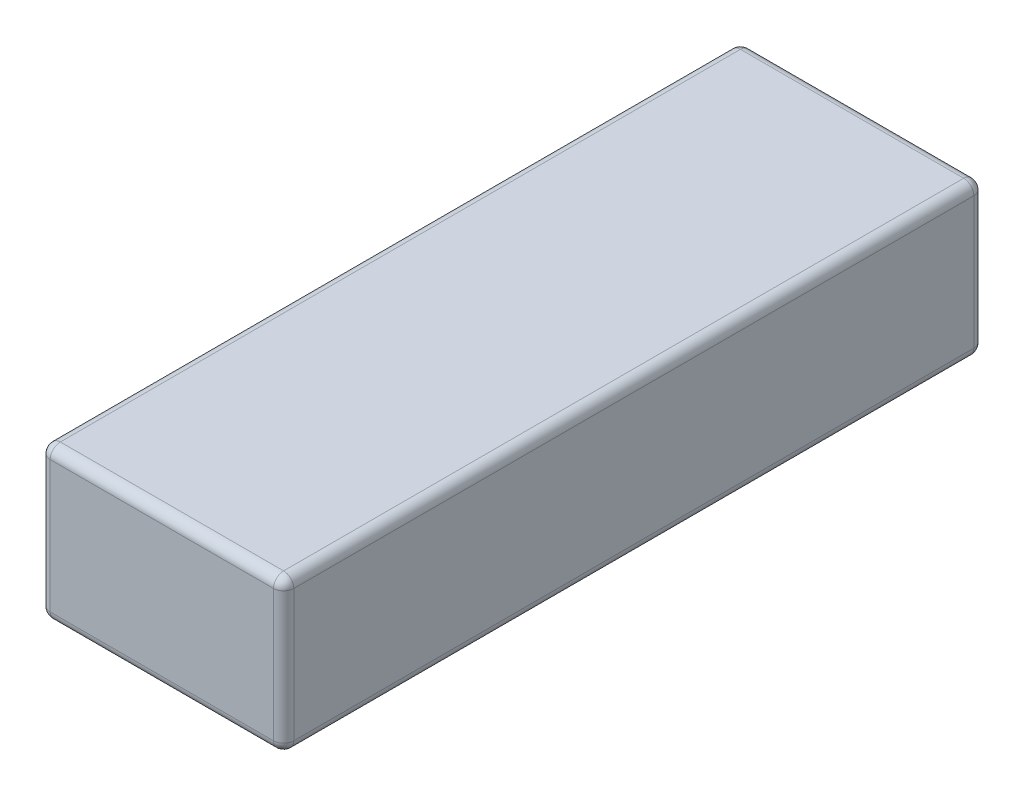
from build123d import *

# Parameters (mm, degrees)
SKETCH_1_W      = 48
SKETCH_1_H      = 30
EXTRUDE_1_DEPTH = 138
FILLET_1_R      = 2


with BuildPart() as part:
    # Эскиз1 → Бобышка-Вытянуть1 (new body)
    with BuildSketch(Plane.XY):
        with Locations((24, 15)):
            Rectangle(SKETCH_1_W, SKETCH_1_H)
    extrude(amount=-EXTRUDE_1_DEPTH)

    # Скругление1
    fillet_1_edges = [part.edges().sort_by_distance(p)[0] for p in [
        (24, 0, -138),
        (48, 15, -138),
        (24, 30, -138),
        (48, 15, 0),
        (24, 0, 0),
        (0, 15, 0),
        (24, 30, 0),
        (0, 15, -138),
        (48, 30, -69),
        (48, 0, -69),
        (0, 0, -69),
        (0, 30, -69),
    ]]
    fillet(fillet_1_edges, radius=FILLET_1_R)


solid = part.part
